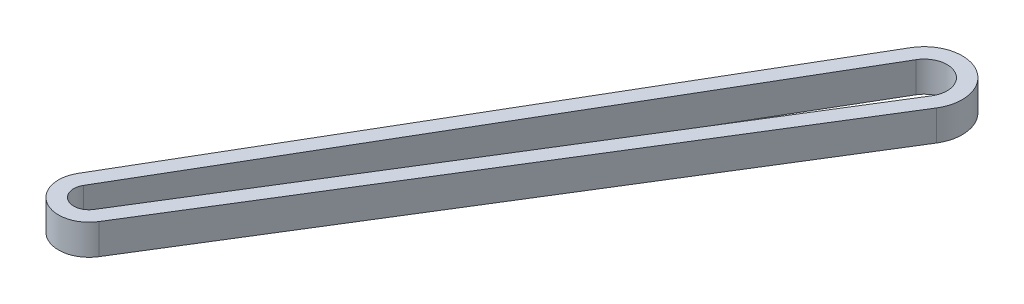
from build123d import *

# Parameters (mm, degrees)
BOSS_EXTRUDE1_DEPTH = 10


with BuildPart() as part:
    # Sketch1 → Boss-Extrude1 (new body)
    with BuildSketch(Plane(origin=(0, 0, 0), x_dir=(1, 0, 0), z_dir=(0, 1, 0))):
        with BuildLine():
            Line((-61.474862228, -81.859961975), (39.557315322, 90.726970032))
            ThreePointArc((39.557315322, 90.726970032), (56.794196553, 95.119711251), (60.97113356, 77.829267438))
            Line((60.97113356, 77.829267438), (-44.343807637, -92.178124051))
            ThreePointArc((-44.343807637, -92.178124051), (-58.004325519, -95.478162112), (-61.474862228, -81.859961975))
        make_face()
        with BuildLine():
            Line((-57.159851804, -84.385963766), (43.872325745, 88.200968242))
            ThreePointArc((43.872325745, 88.200968242), (54.214454484, 90.836612973), (56.720616688, 80.462346685))
            Line((56.720616688, 80.462346685), (-48.594324509, -89.545044803))
            ThreePointArc((-48.594324509, -89.545044803), (-55.42458345, -91.195063834), (-57.159851804, -84.385963766))
        make_face(mode=Mode.SUBTRACT)
    extrude(amount=BOSS_EXTRUDE1_DEPTH)


solid = part.part
